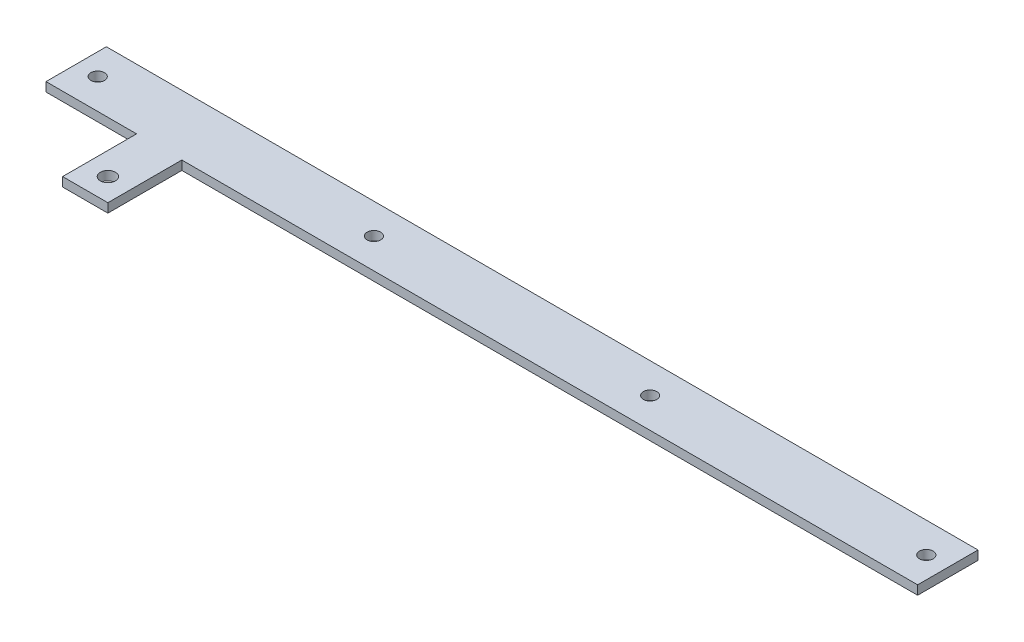
from build123d import *

# Parameters (mm, degrees)
SKETCH1_W           = 1155
SKETCH1_H           = 80
BOSS_EXTRUDE1_DEPTH = 12
SKETCH2_R           = 9
CUT_EXTRUDE1_DEPTH  = 580.007987855
LPATTERN1_COUNT     = 4
LPATTERN1_PITCH     = 366
SKETCH3_W           = 60
SKETCH3_H           = 98
SKETCH3_R           = 10
BOSS_EXTRUDE2_DEPTH = 12


with BuildPart() as part:
    # Sketch1 → Boss-Extrude1 (new body)
    with BuildSketch(Plane(origin=(0, 0, 0), x_dir=(1, 0, 0), z_dir=(0, 1, 0))):
        Rectangle(SKETCH1_W, SKETCH1_H)
    extrude(amount=BOSS_EXTRUDE1_DEPTH)

    # Sketch2 → Cut-Extrude1 (cut, symmetric)
    with BuildSketch(Plane(origin=(0, 12, 0), x_dir=(1, 0, 0), z_dir=(0, 1, 0))):
        with Locations(Location((-549, 0, 0), (0, 0, 270))):
            Circle(SKETCH2_R)
    cut_extrude1 = extrude(amount=CUT_EXTRUDE1_DEPTH, both=True, mode=Mode.SUBTRACT)

    # LPattern1: Cut-Extrude1 ×4
    with Locations(*[(i * LPATTERN1_PITCH, 0, 0) for i in range(1, LPATTERN1_COUNT)]):
        add(cut_extrude1, mode=Mode.SUBTRACT)

    # Sketch3 → Boss-Extrude2 (add)
    with BuildSketch(Plane(origin=(0, 12, 0), x_dir=(1, 0, 0), z_dir=(0, 1, 0))):
        with Locations((-427.5, -89)):
            Rectangle(SKETCH3_W, SKETCH3_H)
        with Locations(Location((-427.5, -108, 0), (0, 0, 270))):
            Circle(SKETCH3_R, mode=Mode.SUBTRACT)
    extrude(amount=-BOSS_EXTRUDE2_DEPTH)


solid = part.part
